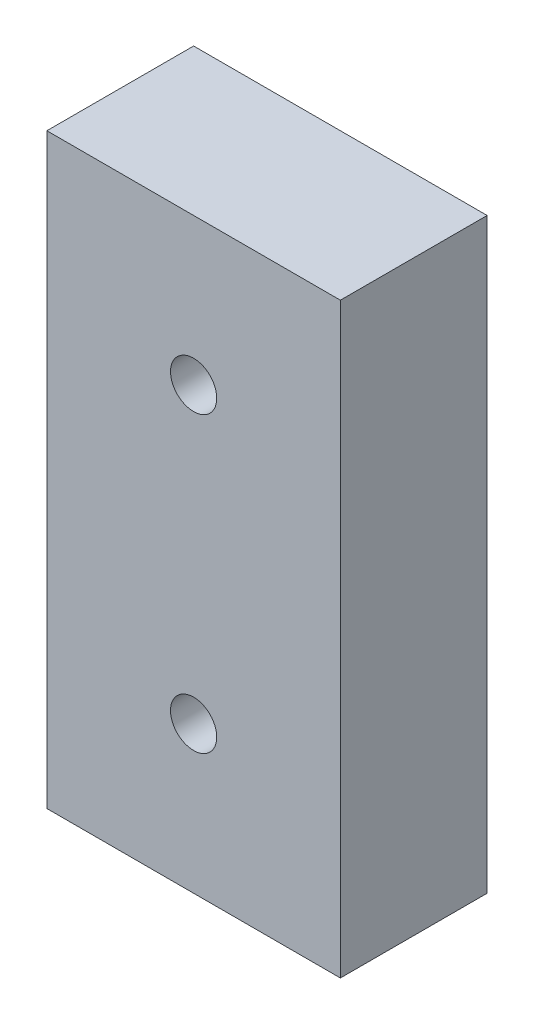
from build123d import *

# Parameters (mm, degrees)
SKETCH_1_W          = 20
SKETCH_1_H          = 40
EXTRUDE_1_DEPTH     = 10
SKETCH_2_R          = 1.575
CUT_EXTRUDE_1_DEPTH = 46.82575695


with BuildPart() as part:
    # 草图1 → 凸台-拉伸1 (new body)
    with BuildSketch(Plane.XY):
        with Locations((10, -20)):
            Rectangle(SKETCH_1_W, SKETCH_1_H)
    extrude(amount=EXTRUDE_1_DEPTH)

    # 草图2 → 切除-拉伸1 (cut, through all)
    with BuildSketch(Plane.XY.offset(10)):
        with Locations((10, -10)):
            Circle(SKETCH_2_R)
        with Locations(Location((10, -30, 0), (0, 0, 180))):
            Circle(SKETCH_2_R)
    extrude(amount=-CUT_EXTRUDE_1_DEPTH, mode=Mode.SUBTRACT)


solid = part.part
